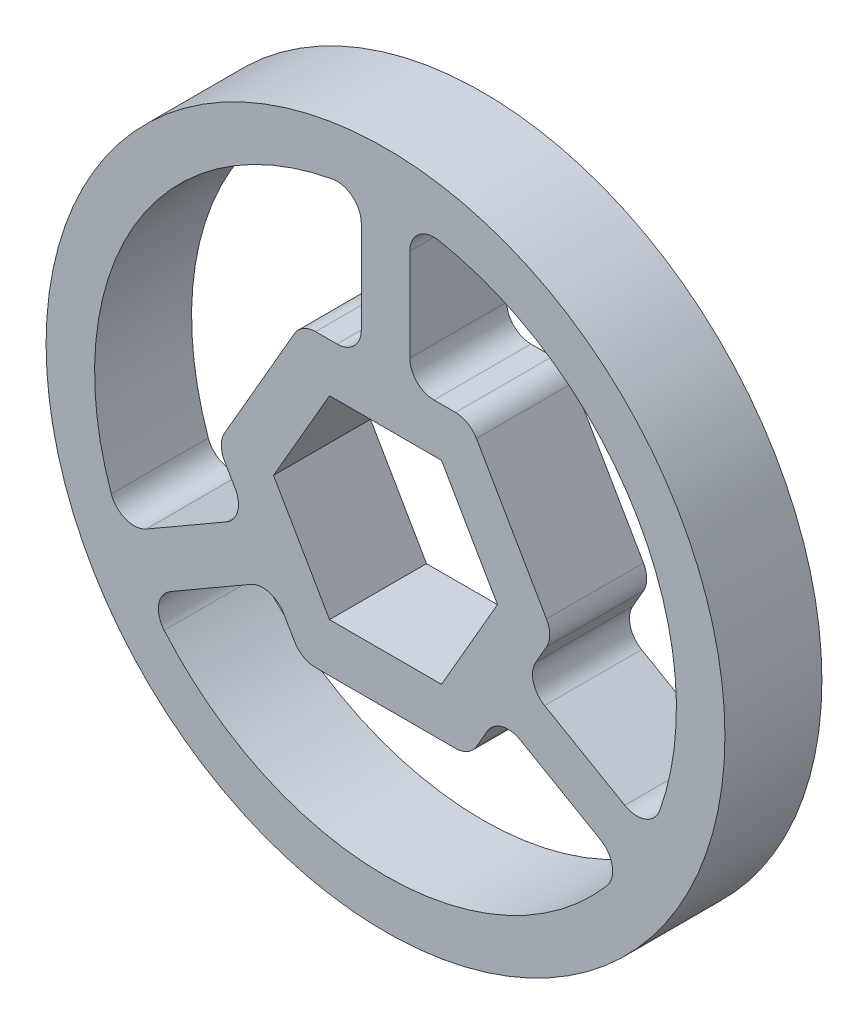
from build123d import *

# Parameters (mm, degrees)
SKETCH1_R             = 22.225
SKETCH1_R_2           = 19.05
BOSS_EXTRUDE1_DEPTH   = 6.35
BOSS_EXTRUDE1_2_DEPTH = 6.35
BOSS_EXTRUDE2_DEPTH   = 6.35
CIRPATTERN1_COUNT     = 3
FILLET2_R             = 1.5875


with BuildPart() as part:
    # Sketch1 → Boss-Extrude1 (new body)
    with BuildSketch(Plane.XY):
        Circle(SKETCH1_R)
        Circle(SKETCH1_R_2, mode=Mode.SUBTRACT)
    extrude(amount=BOSS_EXTRUDE1_DEPTH)



with BuildPart() as body_2:
    # Sketch1 → Boss-Extrude1 2 (new body)
    with BuildSketch(Plane.XY):
        Polygon((-5.499261314, -9.525), (5.499261314, -9.525), (10.998522628, 0), (5.499261314, 9.525), (-5.499261314, 9.525), (-10.998522628, 0), align=None)
        Polygon((3.666174209, -6.35), (7.332348419, 0), (3.666174209, 6.35), (-3.666174209, 6.35), (-7.332348419, 0), (-3.666174209, -6.35), align=None, mode=Mode.SUBTRACT)
    extrude(amount=BOSS_EXTRUDE1_2_DEPTH)


with BuildPart() as part_1:
    add(part.part)

    add(body_2.part)  # Boss-Extrude2 merges body 2
    # Sketch4 → Boss-Extrude2 (add)
    with BuildSketch(Plane.XY):
        with BuildLine():
            Line((-1.5875, 18.98373893), (-1.5875, 9.525))
            Line((-1.5875, 9.525), (1.5875, 9.525))
            Line((1.5875, 9.525), (1.5875, 18.98373893))
            ThreePointArc((1.5875, 18.98373893), (0, 19.05), (-1.5875, 18.98373893))
        make_face()
    boss_extrude2 = extrude(amount=BOSS_EXTRUDE2_DEPTH)

    # CirPattern1: Boss-Extrude2 ×3 about axis
    cirpattern1_axis = Axis((0, 0, 0), (0, 0, 1))
    for i in range(1, CIRPATTERN1_COUNT):
        add(boss_extrude2.rotate(cirpattern1_axis, i * 360 / CIRPATTERN1_COUNT))

    # Fillet2
    fillet2_edges = [part_1.edges().sort_by_distance(p)[0] for p in [
        (-5.499261314, -9.525, 3.175),
        (-10.998522628, 0, 3.175),
        (-5.499261314, 9.525, 3.175),
        (5.499261314, 9.525, 3.175),
        (10.998522628, 0, 3.175),
        (5.499261314, -9.525, 3.175),
        (1.5875, 18.98373893, 3.175),
        (-1.5875, 18.98373893, 3.175),
        (-1.5875, 9.525, 3.175),
        (1.5875, 9.525, 3.175),
        (-17.234150172, -8.117054136, 3.175),
        (-15.646650172, -10.866684793, 3.175),
        (-7.455141971, -6.137315329, 3.175),
        (-9.042641971, -3.387684671, 3.175),
        (15.646650172, -10.866684793, 3.175),
        (17.234150172, -8.117054136, 3.175),
        (9.042641971, -3.387684671, 3.175),
        (7.455141971, -6.137315329, 3.175),
    ]]
    fillet(fillet2_edges, radius=FILLET2_R)


solid = part_1.part
